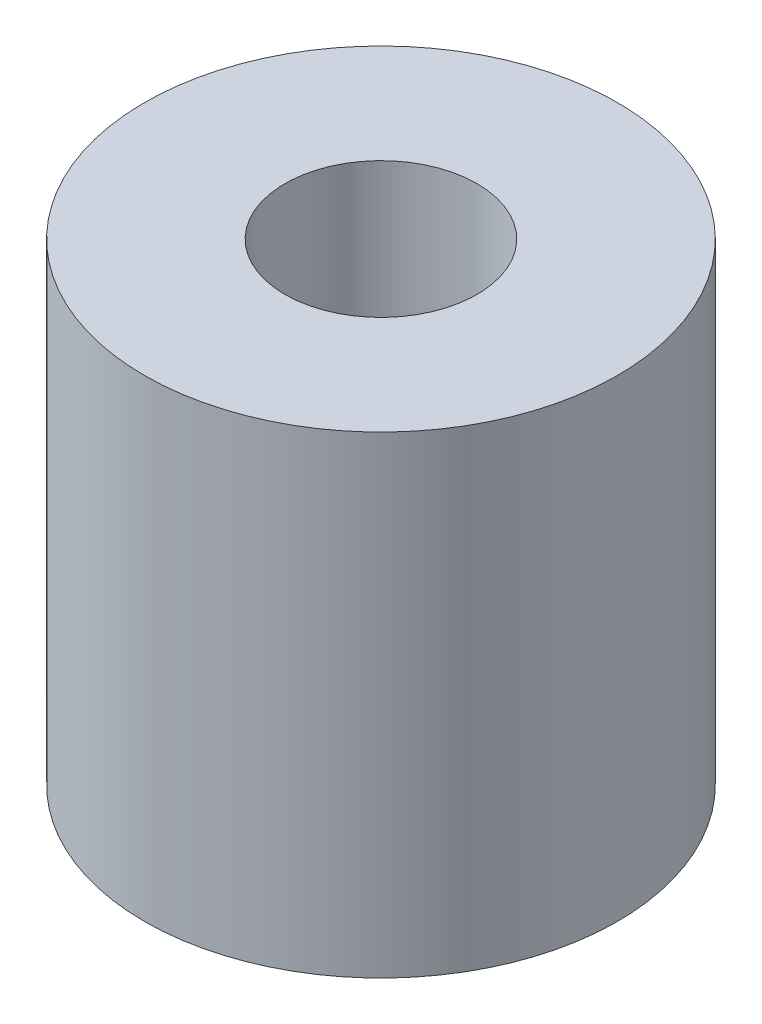
from build123d import *

# Parameters (mm, degrees)
SKETCH1_R           = 4
SKETCH1_R_2         = 1.625
BOSS_EXTRUDE1_DEPTH = 4


with BuildPart() as part:
    # Sketch1 → Boss-Extrude1 (new, symmetric)
    with BuildSketch(Plane(origin=(0, 0, 0), x_dir=(1, 0, 0), z_dir=(0, 1, 0))):
        with Locations(Location((0, 0, 0), (0, 0, 270))):
            Circle(SKETCH1_R)
        with Locations(Location((0, 0, 0), (0, 0, 270))):
            Circle(SKETCH1_R_2, mode=Mode.SUBTRACT)
    extrude(amount=BOSS_EXTRUDE1_DEPTH, both=True)


solid = part.part
